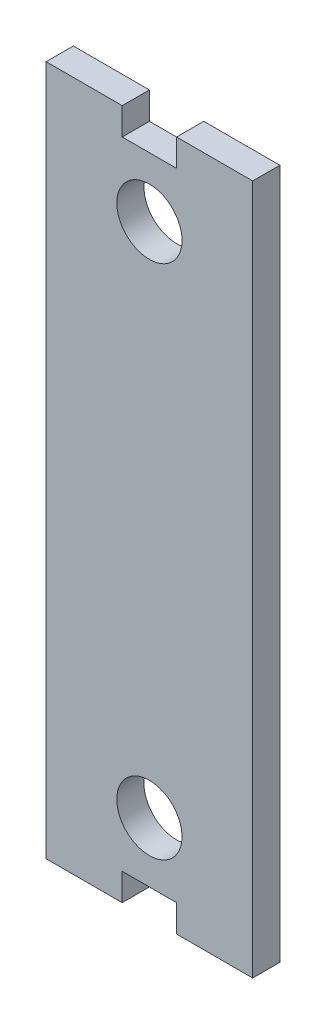
from build123d import *

# Parameters (mm, degrees)
SKETCH2_R           = 6
BOSS_EXTRUDE1_DEPTH = 5


with BuildPart() as part:
    # Sketch2 → Boss-Extrude1 (new body)
    with BuildSketch(Plane.XY):
        Polygon((-5, 63.5), (-19, 63.5), (-19, -63.5), (-5, -63.5), (-5, -58.5), (5, -58.5), (5, -63.5), (19, -63.5), (19, 63.5), (5, 63.5), (5, 58.5), (-5, 58.5), align=None)
        with Locations((0, -47.5)):
            Circle(SKETCH2_R, mode=Mode.SUBTRACT)
        with Locations((0, 47.5)):
            Circle(SKETCH2_R, mode=Mode.SUBTRACT)
    extrude(amount=BOSS_EXTRUDE1_DEPTH)


solid = part.part
